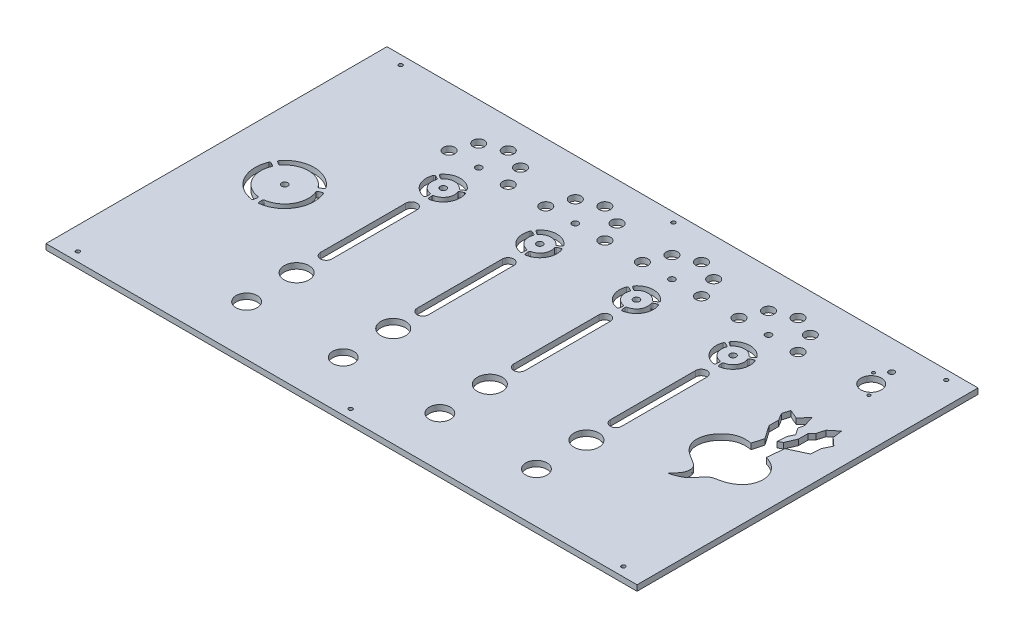
from build123d import *

# Parameters (mm, degrees)
SKETCH1_W           = 660.4
SKETCH1_H           = 381
BOSS_EXTRUDE1_DEPTH = 6.35
SKETCH2_R           = 11.811
SKETCH2_R_2         = 13.843
SKETCH2_R_3         = 3.429
SKETCH2_R_4         = 6.35
CUT_EXTRUDE1_DEPTH  = 382.264491528
CUT_EXTRUDE9_DEPTH  = 382.264491528
LPATTERN1_COUNT     = 4
LPATTERN1_PITCH     = 107.95
SKETCH5_R           = 3.429
CUT_EXTRUDE6_DEPTH  = 382.264491528
SKETCH6_R           = 11.43
SKETCH6_R_2         = 1.651
SKETCH6_R_3         = 3.175
CUT_EXTRUDE7_DEPTH  = 382.264491528
CUT_EXTRUDE8_DEPTH  = 382.264491528
SKETCH12_R          = 2.159
CUT_EXTRUDE10_DEPTH = 382.264491666


with BuildPart() as part:
    # Sketch1 → Boss-Extrude1 (new body)
    with BuildSketch(Plane(origin=(0, 0, 0), x_dir=(1, 0, 0), z_dir=(0, 1, 0))):
        Rectangle(SKETCH1_W, SKETCH1_H)
    extrude(amount=BOSS_EXTRUDE1_DEPTH)

    # Sketch2 → Cut-Extrude1 (cut, through all)
    with BuildSketch(Plane(origin=(0, 6.35, 0), x_dir=(1, 0, 0), z_dir=(0, 1, 0))):
        with BuildLine():
            Line((-155.575, -45.72), (-155.575, 49.53))
            ThreePointArc((-155.575, 49.53), (-161.925, 55.88), (-168.275, 49.53))
            Line((-168.275, 49.53), (-168.275, -45.72))
            ThreePointArc((-168.275, -45.72), (-161.925, -52.07), (-155.575, -45.72))
        make_face()
        with Locations(Location((-161.925, -134.62, 0), (0, 0, 270))):
            Circle(SKETCH2_R)
        with Locations(Location((-161.925, -78.74, 0), (0, 0, 270))):
            Circle(SKETCH2_R_2)
        with Locations(Location((-161.925, 85.09, 0), (0, 0, 270))):
            Circle(SKETCH2_R_3)
        with Locations(Location((-161.925, 124.714, 0), (0, 0, 270))):
            Circle(SKETCH2_R_3)
        with Locations(Location((-194.945, 124.714, 0), (0, 0, 270))):
            Circle(SKETCH2_R_4)
        with Locations(Location((-185.273665915, 148.062665915, 0), (0, 0, 270))):
            Circle(SKETCH2_R_4)
        with Locations(Location((-161.925, 157.734, 0), (0, 0, 270))):
            Circle(SKETCH2_R_4)
        with Locations(Location((-138.576334085, 148.062665915, 0), (0, 0, 270))):
            Circle(SKETCH2_R_4)
        with Locations(Location((-128.905, 124.714, 0), (0, 0, 270))):
            Circle(SKETCH2_R_4)
    cut_extrude1 = extrude(amount=-CUT_EXTRUDE1_DEPTH, mode=Mode.SUBTRACT)

    # Sketch10 → Cut-Extrude9 (cut, through all)
    with BuildSketch(Plane(origin=(0, 6.35, 0), x_dir=(1, 0, 0), z_dir=(0, 1, 0))):
        with BuildLine():
            Line((-176.452321439, 95.262139982), (-173.321168538, 93.069683117))
            ThreePointArc((-173.321168538, 93.069683117), (-172.429330902, 92.850561141), (-171.622933149, 93.290005649))
            ThreePointArc((-171.622933149, 93.290005649), (-161.925, 97.79), (-152.227066851, 93.290005649))
            ThreePointArc((-152.227066851, 93.290005649), (-151.420669098, 92.850561141), (-150.528831462, 93.069683117))
            Line((-150.528831462, 93.069683117), (-147.397678561, 95.262139982))
            ThreePointArc((-147.397678561, 95.262139982), (-146.868332488, 96.12676738), (-147.140486395, 97.103353298))
            ThreePointArc((-147.140486395, 97.103353298), (-161.925, 104.14), (-176.709513605, 97.103353298))
            ThreePointArc((-176.709513605, 97.103353298), (-176.981667512, 96.12676738), (-176.452321439, 95.262139982))
        make_face()
        with BuildLine():
            Line((-145.852007646, 92.584959424), (-149.316307437, 90.969529901))
            ThreePointArc((-149.316307437, 90.969529901), (-149.951991453, 90.30673684), (-149.974620223, 89.388653647))
            ThreePointArc((-149.974620223, 89.388653647), (-150.926477372, 78.74), (-159.672553372, 72.591340704))
            ThreePointArc((-159.672553372, 72.591340704), (-160.456322355, 72.112702019), (-160.712475975, 71.230786982))
            Line((-160.712475975, 71.230786982), (-160.379329085, 67.422900594))
            ThreePointArc((-160.379329085, 67.422900594), (-159.895212829, 66.532159749), (-158.913387662, 66.279558986))
            ThreePointArc((-158.913387662, 66.279558986), (-145.427216058, 75.565), (-144.128874057, 91.887087716))
            ThreePointArc((-144.128874057, 91.887087716), (-144.838545317, 92.611072871), (-145.852007646, 92.584959424))
        make_face()
        with BuildLine():
            Line((-163.470670915, 67.422900594), (-163.137524025, 71.230786982))
            ThreePointArc((-163.137524025, 71.230786982), (-163.393677645, 72.112702019), (-164.177446628, 72.591340704))
            ThreePointArc((-164.177446628, 72.591340704), (-172.923522628, 78.74), (-173.875379777, 89.388653647))
            ThreePointArc((-173.875379777, 89.388653647), (-173.898008547, 90.30673684), (-174.533692563, 90.969529901))
            Line((-174.533692563, 90.969529901), (-177.997992354, 92.584959424))
            ThreePointArc((-177.997992354, 92.584959424), (-179.011454683, 92.611072871), (-179.721125943, 91.887087716))
            ThreePointArc((-179.721125943, 91.887087716), (-178.422783942, 75.565), (-164.936612338, 66.279558986))
            ThreePointArc((-164.936612338, 66.279558986), (-163.954787171, 66.532159749), (-163.470670915, 67.422900594))
        make_face()
    cut_extrude9 = extrude(amount=-CUT_EXTRUDE9_DEPTH, mode=Mode.SUBTRACT)

    # LPattern1: Cut-Extrude1, Cut-Extrude9 ×4
    with Locations(*[(i * LPATTERN1_PITCH, 0, 0) for i in range(1, LPATTERN1_COUNT)]):
        add(cut_extrude1, mode=Mode.SUBTRACT)
        add(cut_extrude9, mode=Mode.SUBTRACT)

    # Sketch5 → Cut-Extrude6 (cut, through all)
    with BuildSketch(Plane(origin=(0, 6.35, 0), x_dir=(1, 0, 0), z_dir=(0, 1, 0))):
        with Locations(Location((-254, 0, 0), (0, 0, 270))):
            Circle(SKETCH5_R)
        with BuildLine():
            Line((-279.987262615, 18.19647718), (-276.863452185, 16.00916157))
            ThreePointArc((-276.863452185, 16.00916157), (-275.942966399, 15.794088628), (-275.128873288, 16.27450809))
            ThreePointArc((-275.128873288, 16.27450809), (-254, 26.67), (-232.871126712, 16.27450809))
            ThreePointArc((-232.871126712, 16.27450809), (-232.057033601, 15.794088628), (-231.136547815, 16.00916157))
            Line((-231.136547815, 16.00916157), (-228.012737385, 18.19647718))
            ThreePointArc((-228.012737385, 18.19647718), (-227.486312333, 19.041330343), (-227.730826638, 20.006272288))
            ThreePointArc((-227.730826638, 20.006272288), (-254, 33.02), (-280.269173362, 20.006272288))
            ThreePointArc((-280.269173362, 20.006272288), (-280.513687667, 19.041330343), (-279.987262615, 18.19647718))
        make_face()
        with BuildLine():
            Line((-225.247757195, 13.407391009), (-228.703933295, 11.795749626))
            ThreePointArc((-228.703933295, 11.795749626), (-229.350434819, 11.106122022), (-229.341425916, 10.160886976))
            ThreePointArc((-229.341425916, 10.160886976), (-230.903102481, -13.335), (-250.470299204, -26.435395066))
            ThreePointArc((-250.470299204, -26.435395066), (-251.293401218, -26.90021065), (-251.56738548, -27.804911196))
            Line((-251.56738548, -27.804911196), (-251.23501981, -31.60386819))
            ThreePointArc((-251.23501981, -31.60386819), (-250.766568035, -32.482192239), (-249.808646645, -32.752907612))
            ThreePointArc((-249.808646645, -32.752907612), (-225.403841167, -16.51), (-223.539473283, 12.746635324))
            ThreePointArc((-223.539473283, 12.746635324), (-224.252880367, 13.440861896), (-225.247757195, 13.407391009))
        make_face()
        with BuildLine():
            Line((-256.76498019, -31.60386819), (-256.43261452, -27.804911196))
            ThreePointArc((-256.43261452, -27.804911196), (-256.706598782, -26.90021065), (-257.529700796, -26.435395066))
            ThreePointArc((-257.529700796, -26.435395066), (-277.096897519, -13.335), (-278.658574084, 10.160886976))
            ThreePointArc((-278.658574084, 10.160886976), (-278.649565181, 11.106122022), (-279.296066705, 11.795749626))
            Line((-279.296066705, 11.795749626), (-282.752242805, 13.407391009))
            ThreePointArc((-282.752242805, 13.407391009), (-283.747119633, 13.440861896), (-284.460526717, 12.746635324))
            ThreePointArc((-284.460526717, 12.746635324), (-282.596158833, -16.51), (-258.191353355, -32.752907612))
            ThreePointArc((-258.191353355, -32.752907612), (-257.233431965, -32.482192239), (-256.76498019, -31.60386819))
        make_face()
    extrude(amount=-CUT_EXTRUDE6_DEPTH, mode=Mode.SUBTRACT)

    # Sketch6 → Cut-Extrude7 (cut, through all)
    with BuildSketch(Plane(origin=(0, 6.35, 0), x_dir=(1, 0, 0), z_dir=(0, 1, 0))):
        with Locations(Location((266.7, 134.62, 0), (0, 0, 270))):
            Circle(SKETCH6_R)
        with Locations(Location((257.048, 146.812, 0), (0, 0, 270))):
            Circle(SKETCH6_R_2)
        with Locations(Location((276.352, 122.428, 0), (0, 0, 270))):
            Circle(SKETCH6_R_2)
        with Locations(Location((266.7, 157.48, 0), (0, 0, 270))):
            Circle(SKETCH6_R_3)
    extrude(amount=-CUT_EXTRUDE7_DEPTH, mode=Mode.SUBTRACT)

    # Sketch7 → Cut-Extrude8 (cut, through all)
    with BuildSketch(Plane(origin=(0, 6.35, 0), x_dir=(1, 0, 0), z_dir=(0, 1, 0))):
        with BuildLine():
            Line((278.925883019, 1.76861208), (255.718928395, 6.258052707))
            Line((255.718928395, 6.258052707), (256.813340096, 10.19357107))
            add(Edge.make_bspline(
                [(256.813340096, 10.19357107), (252.300720713, 11.010812626), (230.846690407, 12.361272455), (209.075137271, -25.361903105), (250.495869654, -43.389553116), (247.397843991, -60.097900354), (232.687395821, -67.827582804), (257.589625428, -59.874457216), (263.3919573, -45.043066921), (297.850707717, -40.871810084), (303.915902814, -14.965786826), (289.347080058, 1.069283757), (282.875974473, 3.885326319), (279.247049249, 5.033611019)],
                knots=[0.041536762, 0.041536762, 0.041536762, 0.041536762, 0.112636564, 0.317898828, 0.358519244, 0.40149926, 0.459605453, 0.498799105, 0.539956935, 0.572148195, 0.793093537, 0.838640534, 0.897634188, 0.897634188, 0.897634188, 0.897634188], degree=3))
            Line((279.247049249, 5.033611019), (278.925883019, 1.76861208))
        make_face()
        with BuildLine():
            Line((256.813340096, 10.19357107), (255.718928395, 6.258052707))
            Line((255.718928395, 6.258052707), (278.925883019, 1.76861208))
            Line((278.925883019, 1.76861208), (279.247049249, 5.033611019))
            add(Edge.make_bspline(
                [(279.247049249, 5.033611019), (274.053007559, 6.677138574), (267.812730683, 7.574771936), (264.198437379, 8.448526765), (263.457907543, 8.638420231)],
                knots=[0.897634188, 0.897634188, 0.897634188, 0.897634188, 0.98207117, 1, 1, 1, 1], degree=3))
            add(Edge.make_bspline(
                [(263.457907543, 8.638420231), (261.74227899, 9.078357473), (259.449628716, 9.716135587), (256.813340096, 10.19357107)],
                knots=[0, 0, 0, 0, 0.041536762, 0.041536762, 0.041536762, 0.041536762], degree=3))
        make_face()
        with BuildLine():
            Line((260.215683353, 22.428440592), (256.813340096, 10.19357107))
            add(Edge.make_bspline(
                [(263.457907543, 8.638420231), (261.74227899, 9.078357473), (259.449628716, 9.716135587), (256.813340096, 10.19357107)],
                knots=[0, 0, 0, 0, 0.041536762, 0.041536762, 0.041536762, 0.041536762], degree=3))
            add(Edge.make_bspline(
                [(279.247049249, 5.033611019), (274.053007559, 6.677138574), (267.812730683, 7.574771936), (264.198437379, 8.448526765), (263.457907543, 8.638420231)],
                knots=[0.897634188, 0.897634188, 0.897634188, 0.897634188, 0.98207117, 1, 1, 1, 1], degree=3))
            Line((279.247049249, 5.033611019), (281.096400017, 23.834243609))
            Line((281.096400017, 23.834243609), (300.487590385, 32.923251233))
            Line((300.487590385, 32.923251233), (301.27566465, 43.930122851))
            Line((301.27566465, 43.930122851), (305.945246549, 53.686213603))
            Line((305.945246549, 53.686213603), (297.323354159, 61.510719409))
            Line((297.323354159, 61.510719409), (295.754119504, 72.495361996))
            Line((295.754119504, 72.495361996), (286.279665621, 64.796047212))
            Line((286.279665621, 64.796047212), (283.682840893, 55.958051847))
            Line((283.682840893, 55.958051847), (279.405808655, 51.079849127))
            Line((279.405808655, 51.079849127), (279.405808655, 40.739678245))
            Line((279.405808655, 40.739678245), (274.425568733, 29.170908636))
            Line((274.425568733, 29.170908636), (269.777977359, 26.502576122))
            Line((269.777977359, 26.502576122), (270.673226136, 37.259291567))
            Line((270.673226136, 37.259291567), (273.591714823, 43.346425114))
            Line((273.591714823, 43.346425114), (268.421820578, 51.079849127))
            Line((268.421820578, 51.079849127), (269.777977359, 56.927253238))
            Line((269.777977359, 56.927253238), (266.330969718, 69.160738354))
            Line((266.330969718, 69.160738354), (257.602101948, 59.843407588))
            Line((257.602101948, 59.843407588), (247.509969314, 64.188727532))
            Line((247.509969314, 64.188727532), (245.091590342, 55.958051847))
            Line((245.091590342, 55.958051847), (249.928348287, 48.017105967))
            Line((249.928348287, 48.017105967), (249.928348287, 37.259291567))
            Line((249.928348287, 37.259291567), (260.215683353, 22.428440592))
        make_face()
    extrude(amount=-CUT_EXTRUDE8_DEPTH, mode=Mode.SUBTRACT)

    # Sketch12 → Cut-Extrude10 (cut, through all)
    with BuildSketch(Plane(origin=(0, 6.35, 0), x_dir=(1, 0, 0), z_dir=(0, 1, 0))):
        with Locations(Location((-304.8, 180.34, 0), (0, 0, 270))):
            Circle(SKETCH12_R)
        with Locations(Location((0, 180.34, 0), (0, 0, 270))):
            Circle(SKETCH12_R)
        with Locations(Location((304.8, 180.34, 0), (0, 0, 270))):
            Circle(SKETCH12_R)
        with Locations(Location((304.8, -180.34, 0), (0, 0, 90))):
            Circle(SKETCH12_R)
        with Locations(Location((0, -180.34, 0), (0, 0, 90))):
            Circle(SKETCH12_R)
        with Locations(Location((-304.8, -180.34, 0), (0, 0, 90))):
            Circle(SKETCH12_R)
    extrude(amount=-CUT_EXTRUDE10_DEPTH, mode=Mode.SUBTRACT)


solid = part.part
